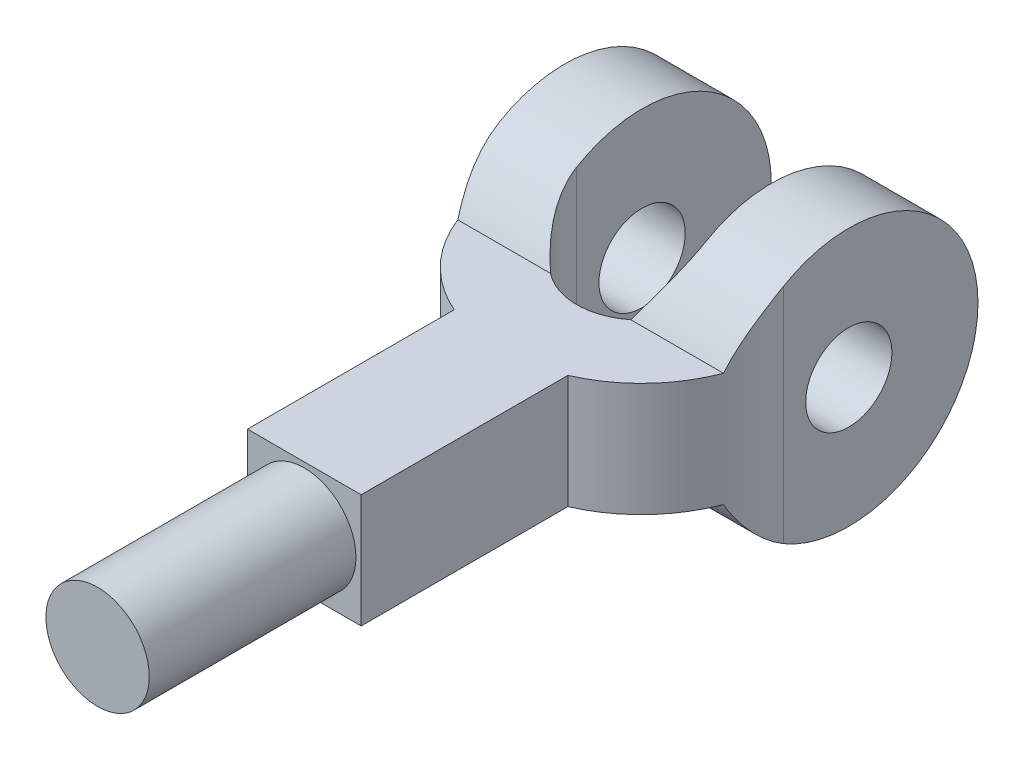
from build123d import *

# Parameters (mm, degrees)
BOSS_EXTRUDE1_DEPTH = 50
SKETCH4_OUTSIDE_W   = 144.624
SKETCH4_OUTSIDE_H   = 79.42
SKETCH4_OUTSIDE_R   = 8.345
CUT_EXTRUDE1_DEPTH  = 99.876606464
SKETCH5_R           = 10
BOSS_EXTRUDE2_DEPTH = 40


with BuildPart() as part:
    # Sketch3 → Boss-Extrude1 (new body)
    with BuildSketch(Plane(origin=(0, 0, 0), x_dir=(1, 0, 0), z_dir=(0, 1, 0))):
        with BuildLine():
            Line((-12.5, 0), (-12.5, 50))
            Line((-12.5, 50), (-27.5, 50))
            Line((-27.5, 50), (-27.5, 0))
            ThreePointArc((-27.5, 0), (-23.00815073, -15.062370331), (-11, -25.204166322))
            Line((-11, -25.204166322), (-11, -65.204166322))
            Line((-11, -65.204166322), (11, -65.204166322))
            Line((11, -65.204166322), (11, -25.204166322))
            ThreePointArc((11, -25.204166322), (23.00815073, -15.062370331), (27.5, 0))
            Line((27.5, 0), (27.5, 37.66))
            Line((27.5, 37.66), (12.5, 37.66))
            Line((12.5, 37.66), (12.5, 0))
            ThreePointArc((12.5, 0), (0, -12.5), (-12.5, 0))
        make_face()
    extrude(amount=BOSS_EXTRUDE1_DEPTH)

    # Sketch4 outside → Cut-Extrude1 (cut, through all)
    # profile 1 of 2: a face of its own
    with BuildSketch(Plane(origin=(27.5, 0, 0), x_dir=(0, 0, -1), z_dir=(1, 0, 0))):
        with Locations((-7.602, 25)):
            Rectangle(SKETCH4_OUTSIDE_W, SKETCH4_OUTSIDE_H)
        with BuildLine():
            Line((-9.789944321, 14), (-65.204166322, 14))
            Line((-65.204166322, 14), (-65.204166322, 36))
            Line((-65.204166322, 36), (-9.789944321, 36))
            ThreePointArc((-9.789944321, 36), (37.66, 25), (-9.789944321, 14))
        make_face(mode=Mode.SUBTRACT)
    # profile 2 of 2: a face of its own
    with BuildSketch(Plane(origin=(27.5, 0, 0), x_dir=(0, 0, -1), z_dir=(1, 0, 0))):
        with Locations((12.66, 25)):
            Circle(SKETCH4_OUTSIDE_R)
    extrude(amount=-CUT_EXTRUDE1_DEPTH, mode=Mode.SUBTRACT)

    # Sketch5 → Boss-Extrude2 (add)
    with BuildSketch(Plane.XY.offset(65.204166322)):
        with Locations((0, 25)):
            Circle(SKETCH5_R)
    extrude(amount=BOSS_EXTRUDE2_DEPTH)


solid = part.part
